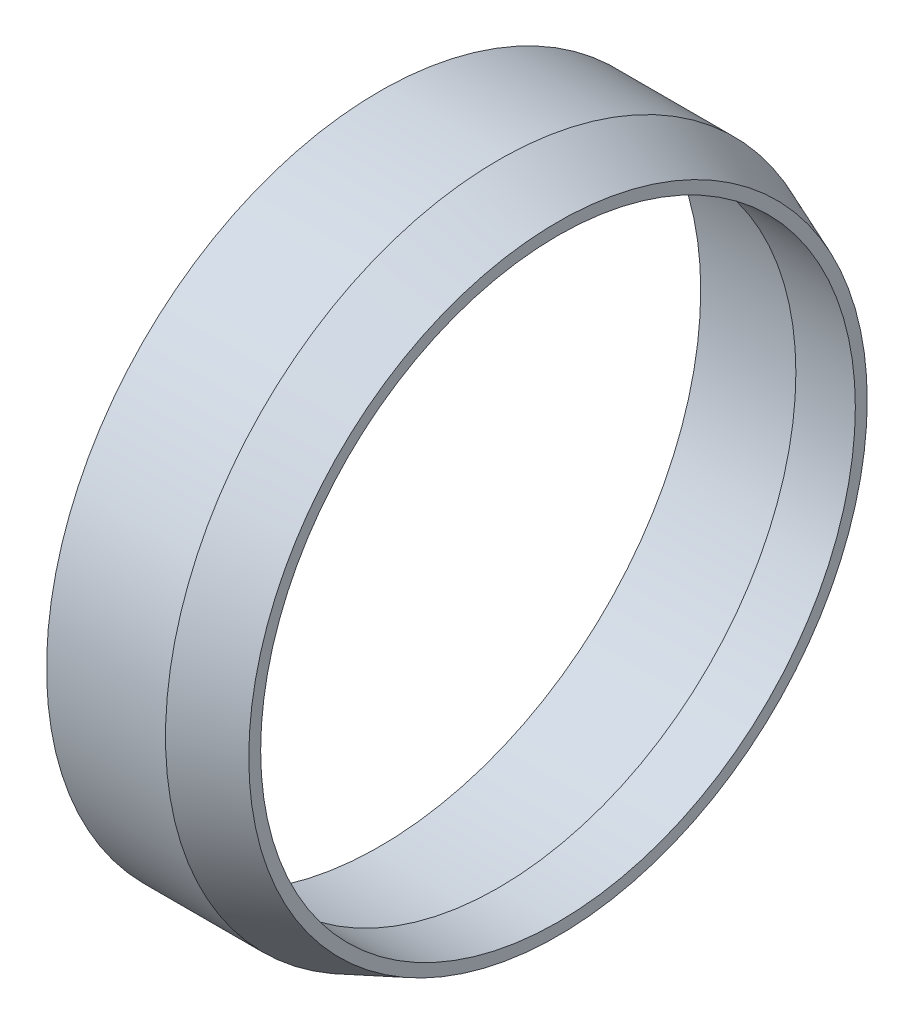
from build123d import *


with BuildPart() as part:
    # Esquisse2 → Base-Révolution (revolve)
    with BuildSketch(Plane(origin=(0, 0, 0), x_dir=(1, 0, 0), z_dir=(0, 1, 0)), mode=Mode.PRIVATE) as base_r_volution_sk:
        Polygon((0, -25), (0, -27), (-10, -27), (-10, -28), (0, -28), (5, -26), (5, -25), align=None)
    revolve(base_r_volution_sk.sketch.rotate(Axis((37.900503033, 0, 0), (-1, 0, 0)), 180), axis=Axis((37.900503033, 0, 0), (-1, 0, 0)))


solid = part.part
